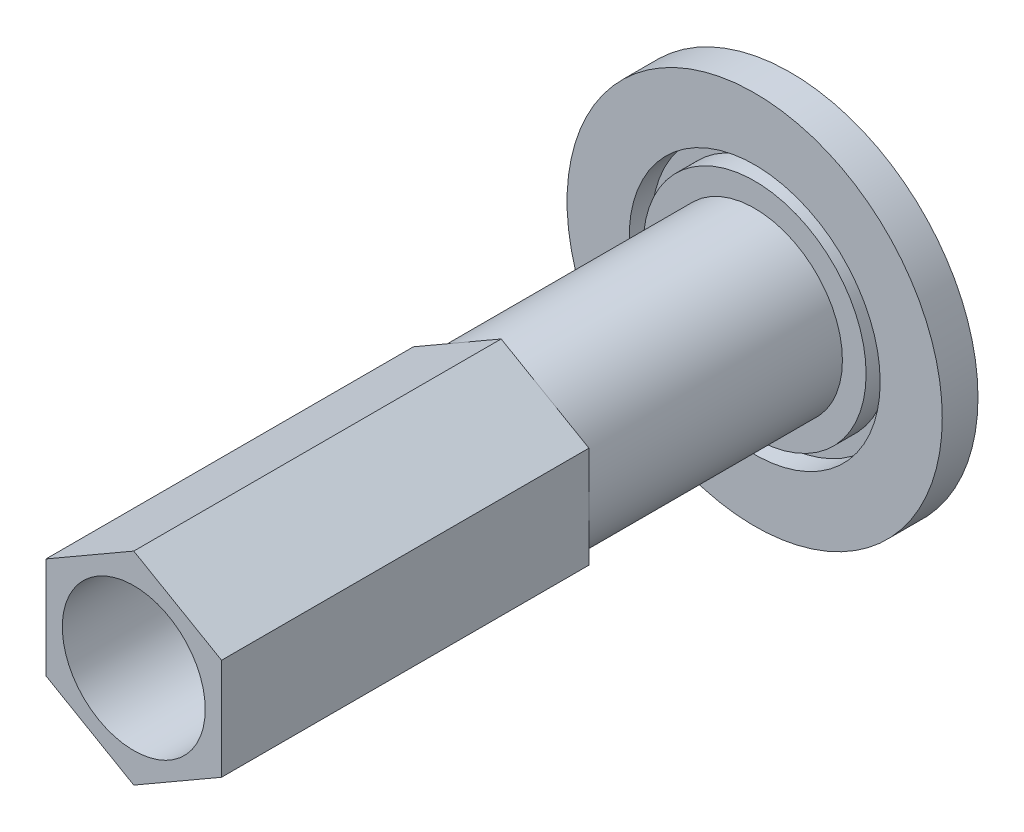
from build123d import *

# Parameters (mm, degrees)
SKETCH2_R           = 16
BOSS_EXTRUDE1_DEPTH = 82.25


with BuildPart() as part:
    # Sketch1 → Revolve1 (revolve)
    with BuildSketch(Plane(origin=(0, 0, 0), x_dir=(1, 0, 0), z_dir=(0, 1, 0))):
        Polygon((0, 0), (16, 0), (16, -71), (19.65, -71), (19.65, 68), (24.95, 68), (24.95, 73), (28.1, 73), (28.1, 68), (42, 68), (42, 76), (16.65, 76), (16.65, 18.004366875), (12, 18.004366875), (12, 24.882682167), (0, 24.882682167), align=None)
    revolve(axis=Axis((0, 0, 39.840023079), (0, 0, -1)))

    # Sketch2 → Boss-Extrude1 (add)
    with BuildSketch(Plane.XY.offset(71)):
        Polygon((0, 22.689865579), (-19.65, 11.34493279), (-19.65, -11.34493279), (0, -22.689865579), (19.65, -11.34493279), (19.65, 11.34493279), align=None)
        Circle(SKETCH2_R, mode=Mode.SUBTRACT)
    extrude(amount=-BOSS_EXTRUDE1_DEPTH)


solid = part.part
